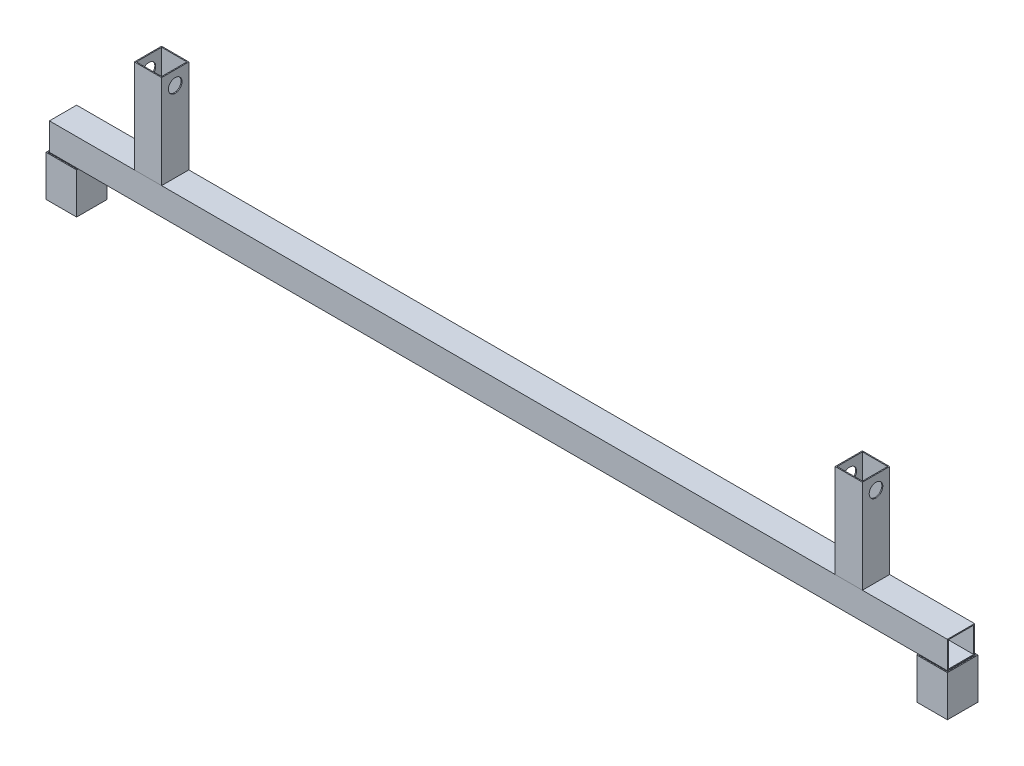
from build123d import *

# Parameters (mm, degrees)
SKETCH15_W                                 = 25.4
SKETCH15_H                                 = 25.4
SKETCH15_W_2                               = 23.622
SKETCH15_H_2                               = 23.622
AL_TUBE_SQUARE_1_SQ_X_035_WALL_1_DEPTH     = 838
SKETCH15_ON_SEGMENT_2_W                    = 25.4
SKETCH15_ON_SEGMENT_2_H                    = 25.4
SKETCH15_ON_SEGMENT_2_W_2                  = 23.622
SKETCH15_ON_SEGMENT_2_H_2                  = 23.622
AL_TUBE_SQUARE_1_SQ_X_035_WALL_1_2_DEPTH   = 101
SKETCH15_ON_SEGMENT_3_W                    = 25.4
SKETCH15_ON_SEGMENT_3_H                    = 25.4
SKETCH15_ON_SEGMENT_3_W_2                  = 23.622
SKETCH15_ON_SEGMENT_3_H_2                  = 23.622
AL_TUBE_SQUARE_1_SQ_X_035_WALL_1_3_DEPTH   = 101
SKETCH16_W                                 = 28.575
SKETCH16_H                                 = 28.575
SKETCH16_W_2                               = 26.797
SKETCH16_H_2                               = 26.797
AL_TUBE_SQUARE_1_125_SQ_X_035_WALL_2_DEPTH = 50.8
SKETCH16_ON_SEGMENT_2_W                    = 28.575
SKETCH16_ON_SEGMENT_2_H                    = 28.575
SKETCH16_ON_SEGMENT_2_W_2                  = 26.797
SKETCH16_ON_SEGMENT_2_H_2                  = 26.797
AL_TUBE_SQUARE_1_125_SQ_X_035_WAL_2_DEPTH  = 50.8
CROQUIS11_R                                = 6.35
CORTAR_EXTRUIR1_DEPTH                      = 768.858


with BuildPart() as part:
    # Sketch15 → Al tube (square) 1 SQ X .035 WALL(1) (new body)
    with BuildSketch(Plane.YZ):
        Rectangle(SKETCH15_W, SKETCH15_H)
        Rectangle(SKETCH15_W_2, SKETCH15_H_2, mode=Mode.SUBTRACT)
    extrude(amount=AL_TUBE_SQUARE_1_SQ_X_035_WALL_1_DEPTH)


with BuildPart() as body_2:
    # Sketch15 on segment 2 (carried to segment 2) → Al tube _square_ 1 SQ X .035 WALL_1 2 (new body)
    with BuildSketch(Plane(origin=(92, -1, 0), x_dir=(-1, 0, 0), z_dir=(0, 1, 0))):
        Rectangle(SKETCH15_ON_SEGMENT_2_W, SKETCH15_ON_SEGMENT_2_H)
        Rectangle(SKETCH15_ON_SEGMENT_2_W_2, SKETCH15_ON_SEGMENT_2_H_2, mode=Mode.SUBTRACT)
    extrude(amount=AL_TUBE_SQUARE_1_SQ_X_035_WALL_1_2_DEPTH)

    # Al tube _square_ 1 SQ X .035 WALL_1 2 en
    split(bisect_by=Plane(origin=(92, 12.7, 0), x_dir=(-1, 0, 0), z_dir=(0, 1, 0)), keep=Keep.TOP)


with BuildPart() as body_3:
    # Sketch15 on segment 3 (carried to segment 3) → Al tube _square_ 1 SQ X .035 WALL_1 3 (new body)
    with BuildSketch(Plane(origin=(746, -1, 0), x_dir=(-1, 0, 0), z_dir=(0, 1, 0))):
        Rectangle(SKETCH15_ON_SEGMENT_3_W, SKETCH15_ON_SEGMENT_3_H)
        Rectangle(SKETCH15_ON_SEGMENT_3_W_2, SKETCH15_ON_SEGMENT_3_H_2, mode=Mode.SUBTRACT)
    extrude(amount=AL_TUBE_SQUARE_1_SQ_X_035_WALL_1_3_DEPTH)

    # Al tube _square_ 1 SQ X .035 WALL_1 3 en
    split(bisect_by=Plane(origin=(746, 12.7, 0), x_dir=(-1, 0, 0), z_dir=(0, 1, 0)), keep=Keep.TOP)


with BuildPart() as body_4:
    # Sketch16 → Al tube (square) 1.125 SQ X .035 WALL(2) (new body)
    with BuildSketch(Plane(origin=(12.7, 0, 0), x_dir=(1, 0, 0), z_dir=(0, -1, 0))):
        Rectangle(SKETCH16_W, SKETCH16_H)
        Rectangle(SKETCH16_W_2, SKETCH16_H_2, mode=Mode.SUBTRACT)
    extrude(amount=AL_TUBE_SQUARE_1_125_SQ_X_035_WALL_2_DEPTH)

    # Recortar/Extender1
    split(bisect_by=Plane(origin=(419, -12.7, 0), x_dir=(1, 0, 0), z_dir=(0, -1, 0)), keep=Keep.TOP)


with BuildPart() as body_5:
    # Sketch16 on segment 2 (carried to segment 2) → Al tube _square_ 1.125 SQ X .035 WAL 2 (new body)
    with BuildSketch(Plane(origin=(825.3, 0, 0), x_dir=(1, 0, 0), z_dir=(0, -1, 0))):
        Rectangle(SKETCH16_ON_SEGMENT_2_W, SKETCH16_ON_SEGMENT_2_H)
        Rectangle(SKETCH16_ON_SEGMENT_2_W_2, SKETCH16_ON_SEGMENT_2_H_2, mode=Mode.SUBTRACT)
    extrude(amount=AL_TUBE_SQUARE_1_125_SQ_X_035_WAL_2_DEPTH)

    # Recortar/Extender1
    split(bisect_by=Plane(origin=(419, -12.7, 0), x_dir=(1, 0, 0), z_dir=(0, -1, 0)), keep=Keep.TOP)


with BuildPart() as cortar_extruir1_tool:
    # Croquis11 → Cortar-Extruir1 (new body)
    with BuildSketch(Plane(origin=(758.7, 0, 0), x_dir=(0, 0, -1), z_dir=(1, 0, 0))):
        with Locations(Location((0, 87.3, 0), (0, 0, 180))):
            Circle(CROQUIS11_R)
    extrude(amount=-CORTAR_EXTRUIR1_DEPTH)


with BuildPart() as body_2_1:
    add(body_2.part)

    # Cortar-Extruir1: cut by cortar_extruir1_tool
    add(cortar_extruir1_tool.part, mode=Mode.SUBTRACT)


with BuildPart() as body_3_1:
    add(body_3.part)

    # Cortar-Extruir1: cut by cortar_extruir1_tool
    add(cortar_extruir1_tool.part, mode=Mode.SUBTRACT)


solid = Compound([part.part, body_4.part, body_5.part, body_2_1.part, body_3_1.part])
